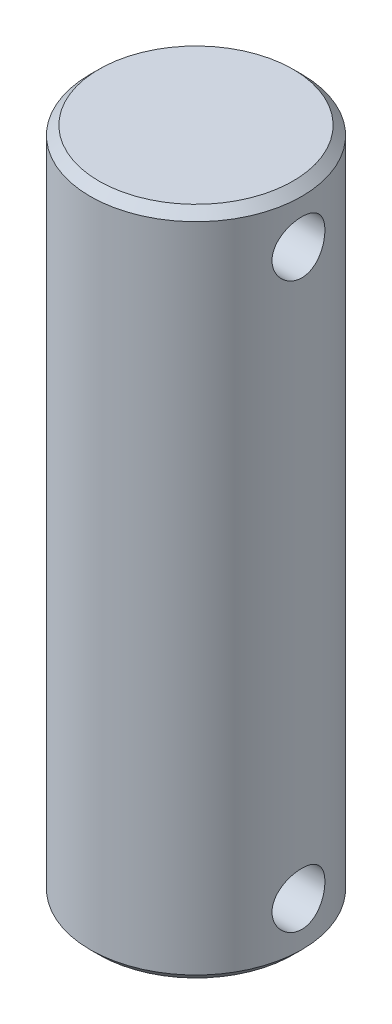
from build123d import *

# Parameters (mm, degrees)
SKETCH1_R               = 6
BOSS_EXTRUDE1_DEPTH     = 38
CUT_EXTRUDE1_DEPTH      = 39.935844668
CUT_EXTRUDE1_DEPTH_BACK = 39.935844668
SKETCH2_R               = 1.5
CHAMFER1_SIZE           = 0.5


with BuildPart() as part:
    # Sketch1 → Boss-Extrude1 (new body)
    with BuildSketch(Plane(origin=(0, 0, 0), x_dir=(1, 0, 0), z_dir=(0, 1, 0))):
        with Locations(Location((0, 0, 0), (0, 0, 270))):
            Circle(SKETCH1_R)
    extrude(amount=BOSS_EXTRUDE1_DEPTH)

    # Sketch2 → Cut-Extrude1 (cut, two sides: drawn at the far end of the back side and taken through both)
    with BuildSketch(Plane(origin=(0, 0, 0), x_dir=(0, 0, -1), z_dir=(1, 0, 0)).offset(-CUT_EXTRUDE1_DEPTH_BACK)):
        with Locations((0, 3)):
            Circle(SKETCH2_R)
        with Locations((0, 35)):
            Circle(SKETCH2_R)
    extrude(amount=CUT_EXTRUDE1_DEPTH + CUT_EXTRUDE1_DEPTH_BACK, mode=Mode.SUBTRACT)

    # Chamfer1
    chamfer1_edges = [part.edges().sort_by_distance(p)[0] for p in [
        (0, 0, -6),
        (0, 38, -6),
    ]]
    chamfer(chamfer1_edges, length=CHAMFER1_SIZE)


solid = part.part
